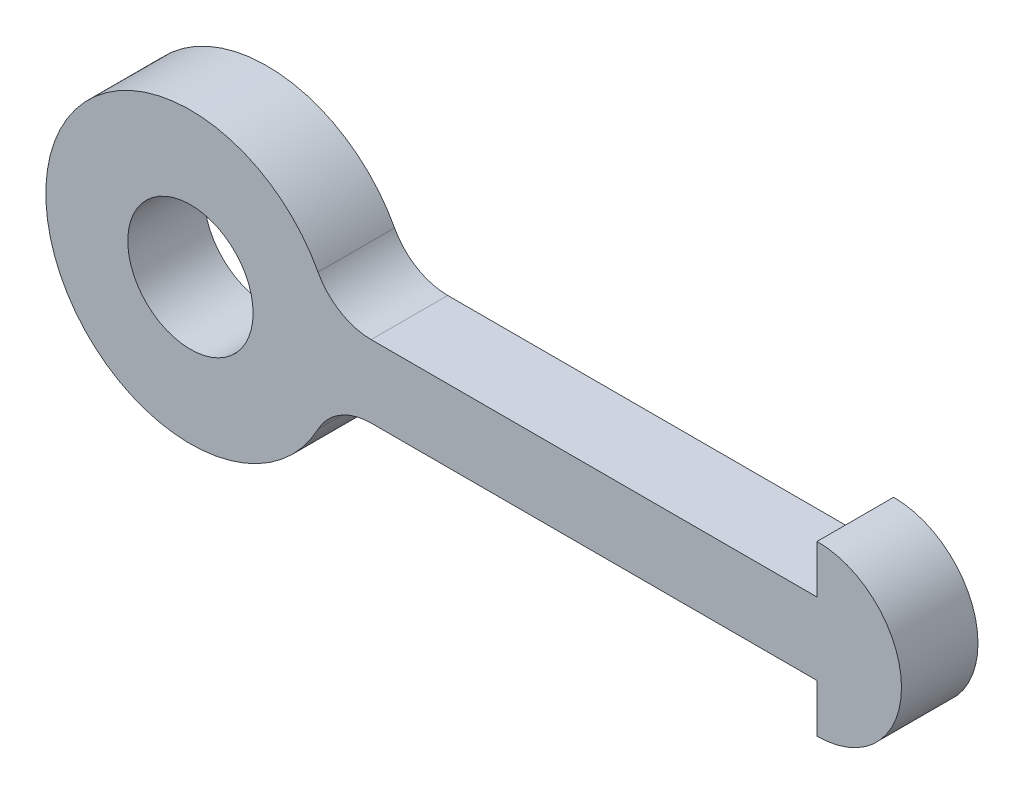
from build123d import *

# Parameters (mm, degrees)
BOSS_EXTRUDE1_DEPTH = 1.5875
SKETCH3_R           = 6
BOSS_EXTRUDE2_DEPTH = 3.175
SKETCH4_R           = 2.6
CUT_EXTRUDE1_DEPTH  = 24.023479863
BOSS_EXTRUDE3_DEPTH = 3.175
FILLET1_R           = 2.5


with BuildPart() as part:
    # Sketch2 → Boss-Extrude1 (new, symmetric)
    with BuildSketch(Plane.XY):
        with BuildLine():
            ThreePointArc((10, -3.5), (13.5, 0), (10, 3.5))
            Line((10, 3.5), (10, 1.5))
            Line((10, 1.5), (-10, 1.5))
            Line((-10, 1.5), (-10, -1.5))
            Line((-10, -1.5), (10, -1.5))
            Line((10, -1.5), (10, -3.5))
        make_face()
    extrude(amount=BOSS_EXTRUDE1_DEPTH, both=True)



with BuildPart() as body_2:
    # Sketch3 → Boss-Extrude2 (new body)
    with BuildSketch(Plane.XY.offset(1.5875)):
        with Locations((-16, 0)):
            Circle(SKETCH3_R)
    extrude(amount=-BOSS_EXTRUDE2_DEPTH)

    # Sketch4 → Cut-Extrude1 (cut, through all)
    with BuildSketch(Plane.XY.offset(1.5875)):
        with Locations((-16, 0)):
            Circle(SKETCH4_R)
    extrude(amount=-CUT_EXTRUDE1_DEPTH, mode=Mode.SUBTRACT)


with BuildPart() as part_1:
    add(part.part)

    add(body_2.part)  # Boss-Extrude3 merges body 2
    # Sketch6 → Boss-Extrude3 (add)
    with BuildSketch(Plane.XY.offset(1.5875)):
        Polygon((-10, -1.5), (-10, 0), (-10.190524981, -1.5), align=None)
    boss_extrude3 = extrude(amount=-BOSS_EXTRUDE3_DEPTH)

    # Mirror1: Boss-Extrude3 across plane
    add(boss_extrude3.mirror(Plane.ZX))

    # Fillet1
    fillet1_edges = [part_1.edges().sort_by_distance(p)[0] for p in [
        (-10.190524981, -1.5, 0),
        (-10.190524981, 1.5, 0),
    ]]
    fillet(fillet1_edges, radius=FILLET1_R)


solid = part_1.part
